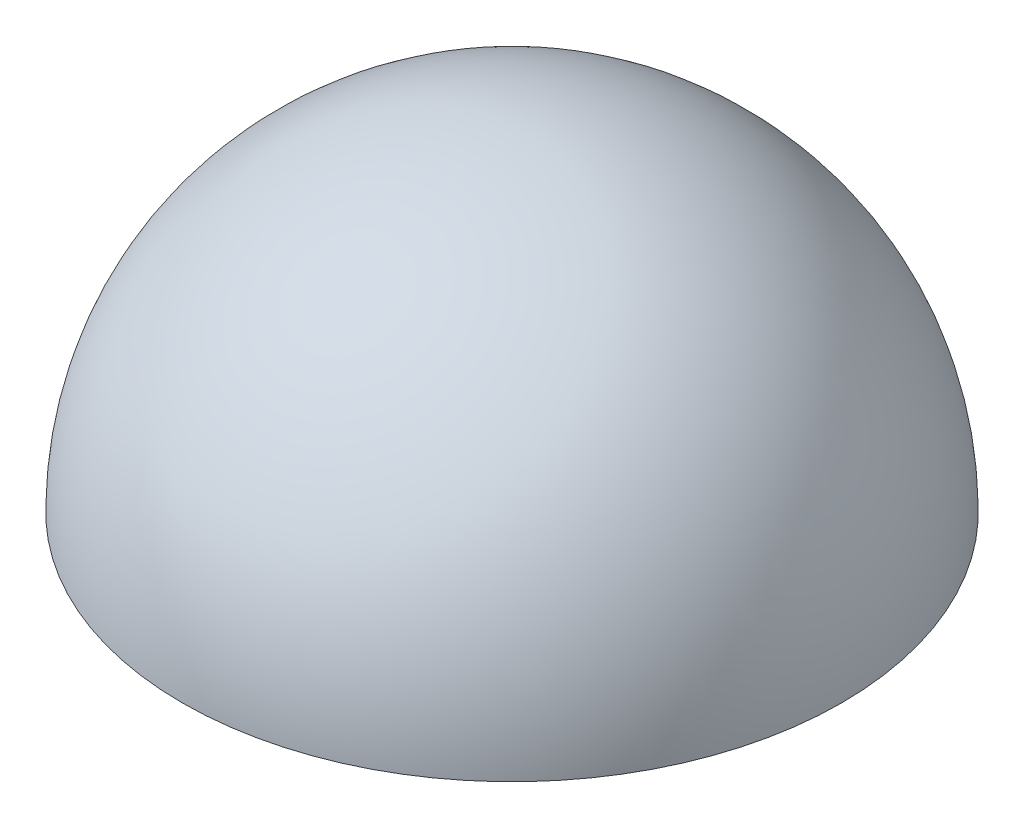
from build123d import *

# Parameters (mm, degrees)
SHELL9_T = -1


with BuildPart() as part:
    # Sketch1 → Revolve3 (revolve)
    with BuildSketch(Plane.XY):
        with BuildLine():
            ThreePointArc((0, 80), (56.568542495, 56.568542495), (80, 0))
            Line((80, 0), (0, 0))
            Line((0, 0), (0, 80))
        make_face()
    revolve(axis=Axis((0, 80, 0), (0, -1, 0)))

    # Shell9
    shell9_openings = [part.faces().sort_by_distance(p)[0] for p in [
        (0, 0, 0),
    ]]
    offset(amount=SHELL9_T, openings=shell9_openings, kind=Kind.INTERSECTION)


solid = part.part
